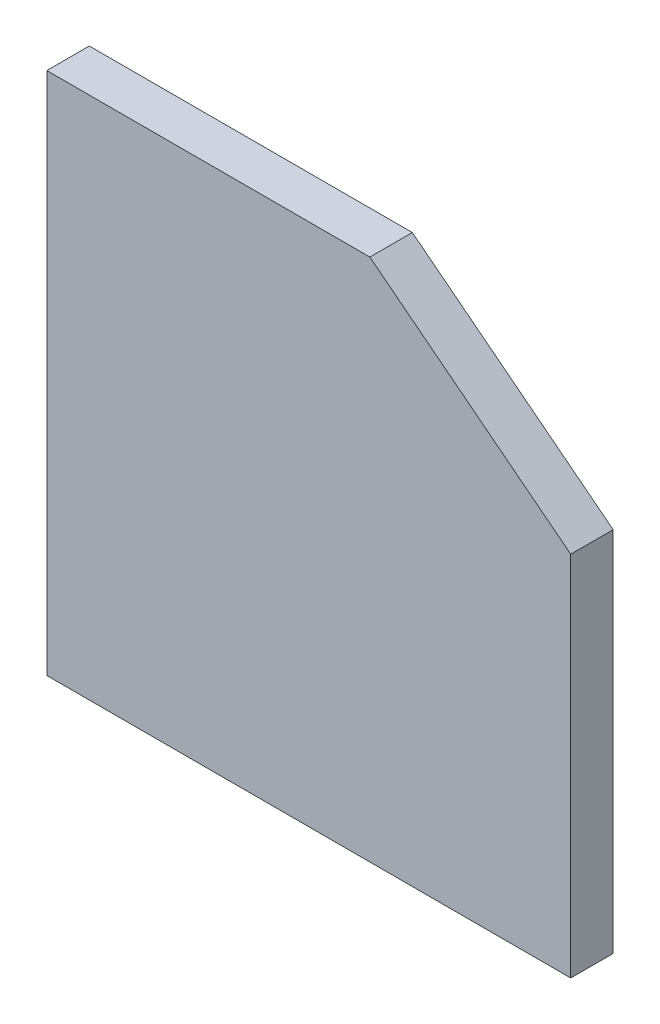
from build123d import *

# Parameters (mm, degrees)
BOSS_EXTRUDE1_DEPTH = 3


with BuildPart() as part:
    # Sketch1 → Boss-Extrude1 (new body)
    with BuildSketch(Plane.XY):
        Polygon((37, 25.918093444), (22.815806435, 37), (0, 37), (0, 0), (37, 0), align=None)
    extrude(amount=BOSS_EXTRUDE1_DEPTH)


solid = part.part
